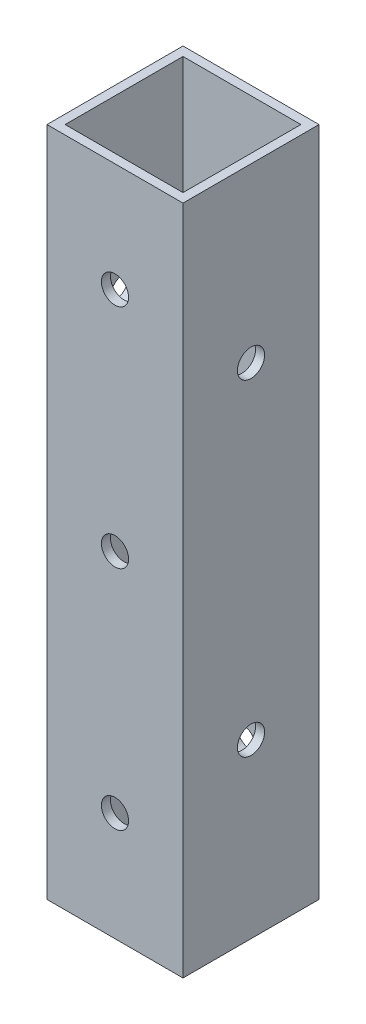
from build123d import *

# Parameters (mm, degrees)
SKETCH_1_W          = 15
SKETCH_1_H          = 15
SKETCH_1_W_2        = 13
SKETCH_1_H_2        = 13
EXTRUDE_1_DEPTH     = 74
SKETCH_2_R          = 1.5
CUT_EXTRUDE_1_DEPTH = 76.876544465
SKETCH_3_R          = 1.5
CUT_EXTRUDE_2_DEPTH = 76.876544465


with BuildPart() as part:
    # 草图1 → 凸台-拉伸1 (new body)
    with BuildSketch(Plane(origin=(0, 0, 0), x_dir=(1, 0, 0), z_dir=(0, 1, 0))):
        Rectangle(SKETCH_1_W, SKETCH_1_H)
        Rectangle(SKETCH_1_W_2, SKETCH_1_H_2, mode=Mode.SUBTRACT)
    extrude(amount=EXTRUDE_1_DEPTH)

    # 草图2 → 切除-拉伸1 (cut, through all)
    with BuildSketch(Plane.XY.offset(7.5)):
        with Locations((0, 62)):
            Circle(SKETCH_2_R)
        with Locations((0, 37)):
            Circle(SKETCH_2_R)
        with Locations((0, 12)):
            Circle(SKETCH_2_R)
    extrude(amount=-CUT_EXTRUDE_1_DEPTH, mode=Mode.SUBTRACT)

    # 草图3 → 切除-拉伸2 (cut, through all)
    with BuildSketch(Plane(origin=(7.5, 0, 0), x_dir=(0, 0, -1), z_dir=(1, 0, 0))):
        with Locations((0, 55)):
            Circle(SKETCH_3_R)
        with Locations((0, 19)):
            Circle(SKETCH_3_R)
    extrude(amount=-CUT_EXTRUDE_2_DEPTH, mode=Mode.SUBTRACT)


solid = part.part
